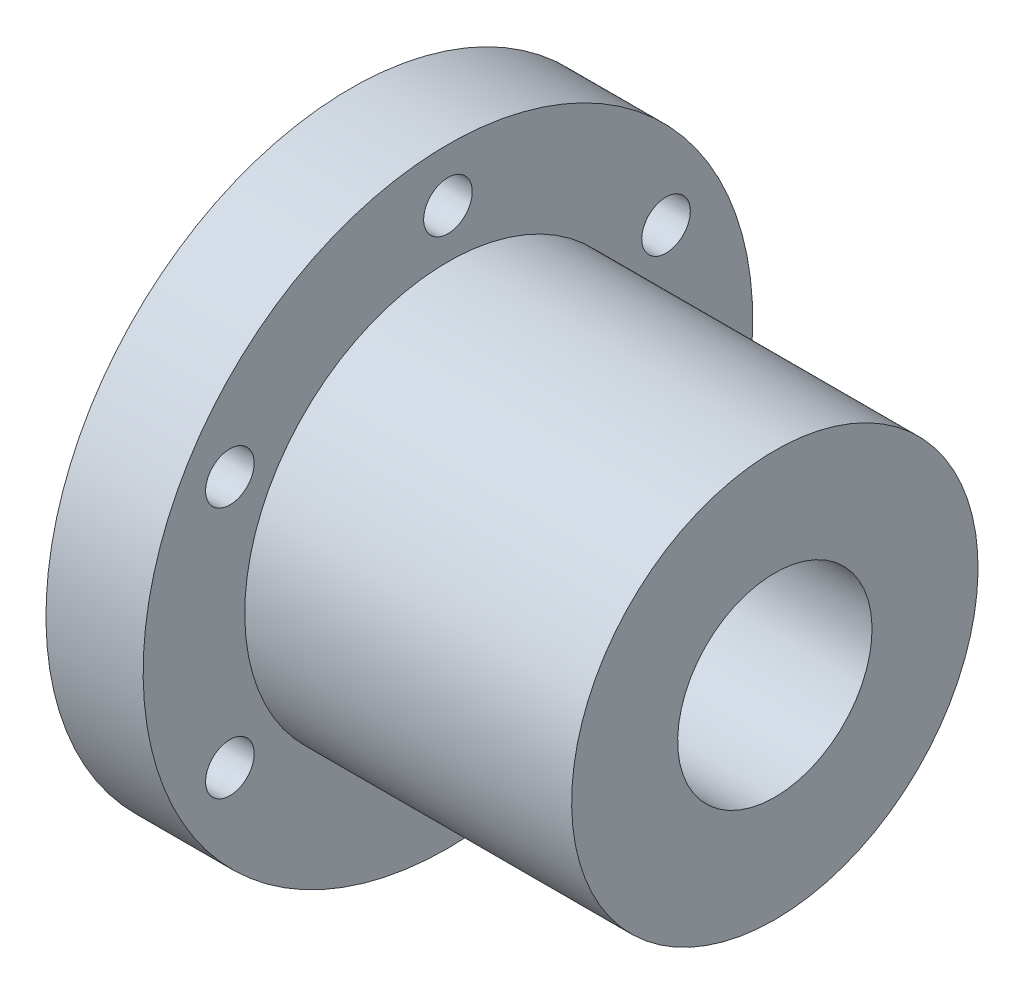
from build123d import *

# Parameters (mm, degrees)
CUT_EXTRUDE1_REACH = 70.443
SKETCH2_R          = 2.75
SKETCH3_R          = 4.75
CUT_EXTRUDE2_DEPTH = 5.5
CIRPATTERN1_COUNT  = 6


with BuildPart() as part:
    # Sketch1 → Revolve1 (revolve)
    with BuildSketch(Plane.XY, mode=Mode.PRIVATE) as revolve1_sk:
        Polygon((-24, 34.5), (-13, 34.5), (-13, 23), (24, 23), (24, 11), (-24, 11), align=None)
    revolve(revolve1_sk.sketch.rotate(Axis((-82.106015927, 0, 0), (1, 0, 0)), 180), axis=Axis((-82.106015927, 0, 0), (1, 0, 0)))

    # Sketch2 → Cut-Extrude1 (cut, up to next)
    with BuildSketch(Plane.ZY.offset(24), mode=Mode.PRIVATE) as cut_extrude1_sk1:
        with Locations(Location((0, -28.5, 0), (0, 0, 270))):
            Circle(SKETCH2_R)
    cut_extrude1_tool1 = extrude(cut_extrude1_sk1.sketch, amount=-CUT_EXTRUDE1_REACH, mode=Mode.PRIVATE) & part.part
    cut_extrude1 = cut_extrude1_tool1.solids().sort_by_distance((-24, -28.5, 0))[0]
    add(cut_extrude1, mode=Mode.SUBTRACT)

    # Sketch3 → Cut-Extrude2 (cut)
    with BuildSketch(Plane.ZY.offset(24)):
        with Locations(Location((0, -28.5, 0), (0, 0, 270))):
            Circle(SKETCH3_R)
    cut_extrude2 = extrude(amount=-CUT_EXTRUDE2_DEPTH, mode=Mode.SUBTRACT)

    # CirPattern1: Cut-Extrude1, Cut-Extrude2 ×6 about axis
    cirpattern1_axis = Axis((0, 0, 0), (1, 0, 0))
    add([cut_extrude1.rotate(cirpattern1_axis, i * 360 / CIRPATTERN1_COUNT) for i in range(1, CIRPATTERN1_COUNT)], mode=Mode.SUBTRACT)
    add([cut_extrude2.rotate(cirpattern1_axis, i * 360 / CIRPATTERN1_COUNT) for i in range(1, CIRPATTERN1_COUNT)], mode=Mode.SUBTRACT)


solid = part.part
